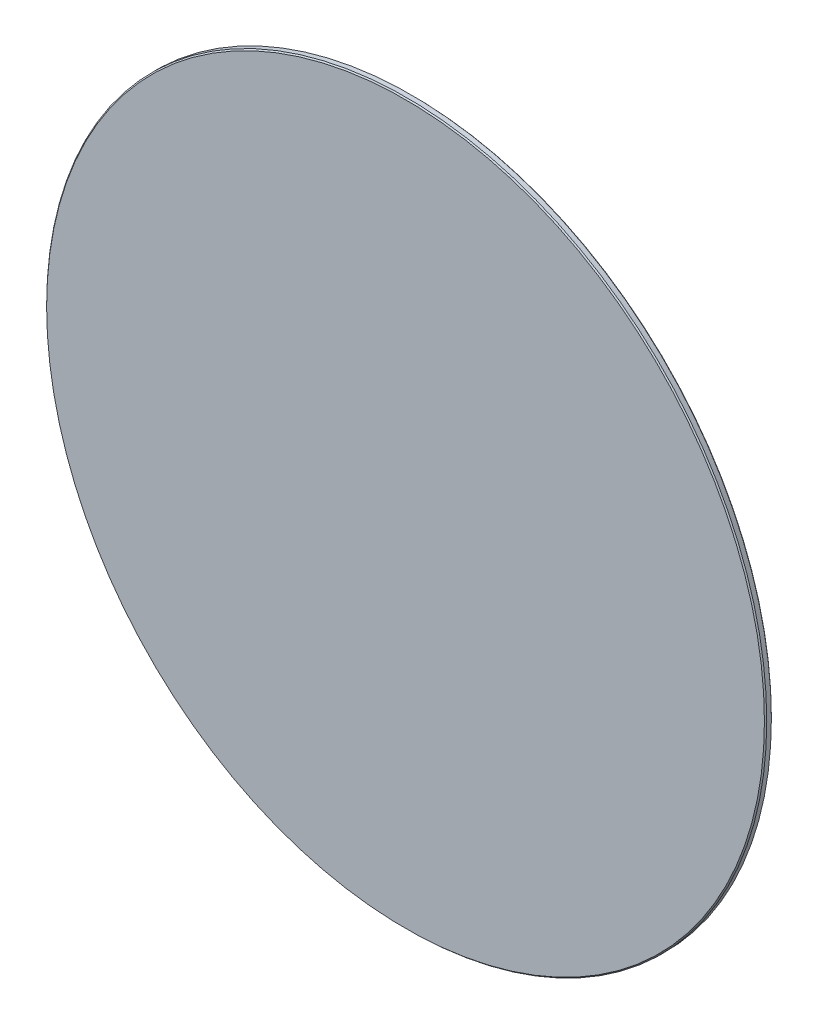
from build123d import *

# Parameters (mm, degrees)
SKETCH1_R           = 155
BOSS_EXTRUDE1_DEPTH = 3
CHAMFER1_SIZE       = 0.5


with BuildPart() as part:
    # Sketch1 → Boss-Extrude1 (new body)
    with BuildSketch(Plane.XY):
        Circle(SKETCH1_R)
    extrude(amount=BOSS_EXTRUDE1_DEPTH)

    # Chamfer1
    chamfer1_edges = [part.edges().sort_by_distance(p)[0] for p in [
        (-155, 0, 0),
        (-155, 0, 3),
    ]]
    chamfer(chamfer1_edges, length=CHAMFER1_SIZE)


solid = part.part
